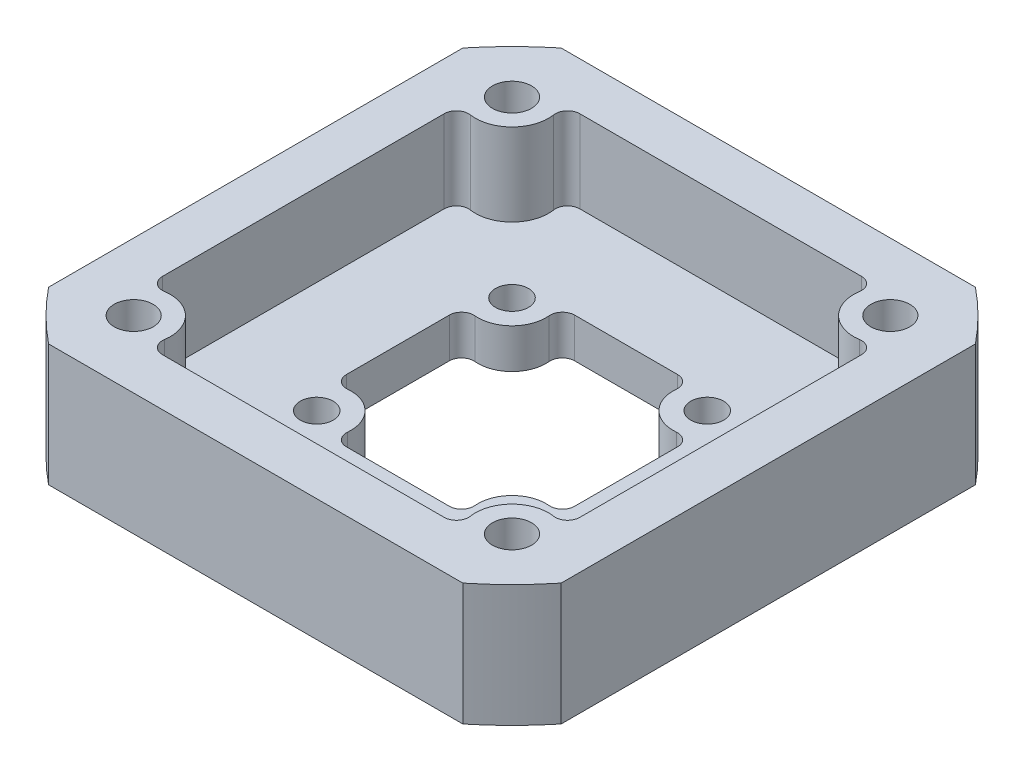
from build123d import *

# Parameters (mm, degrees)
SKETCH1_R           = 1.6
BOSS_EXTRUDE1_DEPTH = 10
SKETCH1_3_R         = 1.35
BOSS_EXTRUDE2_DEPTH = 3.25
FILLET1_R           = 1


with BuildPart() as part:
    # Sketch1 → Boss-Extrude1 (new body)
    with BuildSketch(Plane(origin=(0, 0, 0), x_dir=(1, 0, 0), z_dir=(0, 1, 0))):
        with BuildLine():
            Line((16.971, 21), (-16.971, 21))
            ThreePointArc((-16.971, 21), (-19.092078518, 19.092078518), (-21, 16.971))
            Line((-21, 16.971), (-21, -16.971))
            ThreePointArc((-21, -16.971), (-19.092078518, -19.092078518), (-16.971, -21))
            Line((-16.971, -21), (16.971, -21))
            ThreePointArc((16.971, -21), (19.092078518, -19.092078518), (21, -16.971))
            Line((21, -16.971), (21, 16.971))
            ThreePointArc((21, 16.971), (19.092078518, 19.092078518), (16.971, 21))
        make_face()
        with Locations((-15.5, -15.5)):
            Circle(SKETCH1_R, mode=Mode.SUBTRACT)
        with Locations((15.5, -15.5)):
            Circle(SKETCH1_R, mode=Mode.SUBTRACT)
        with Locations((-15.5, 15.5)):
            Circle(SKETCH1_R, mode=Mode.SUBTRACT)
        with BuildLine():
            Line((-17.1, -12.962284492), (-17.1, 12.962284492))
            ThreePointArc((-17.1, 12.962284492), (-13.378679656, 13.378679656), (-12.962284492, 17.1))
            Line((-12.962284492, 17.1), (12.962284492, 17.1))
            ThreePointArc((12.962284492, 17.1), (13.378679656, 13.378679656), (17.1, 12.962284492))
            Line((17.1, 12.962284492), (17.1, -12.962284492))
            ThreePointArc((17.1, -12.962284492), (13.378679656, -13.378679656), (12.962284492, -17.1))
            Line((12.962284492, -17.1), (-12.962284492, -17.1))
            ThreePointArc((-12.962284492, -17.1), (-13.378679656, -13.378679656), (-17.1, -12.962284492))
        make_face(mode=Mode.SUBTRACT)
        with Locations((15.5, 15.5)):
            Circle(SKETCH1_R, mode=Mode.SUBTRACT)
    extrude(amount=BOSS_EXTRUDE1_DEPTH)

    # Sketch1<3> → Boss-Extrude2 (add)
    with BuildSketch(Plane(origin=(0, 0, 0), x_dir=(1, 0, 0), z_dir=(0, 1, 0))):
        with BuildLine():
            ThreePointArc((-12.962284492, 17.1), (-13.378679656, 13.378679656), (-17.1, 12.962284492))
            Line((-17.1, 12.962284492), (-17.1, -12.962284492))
            ThreePointArc((-17.1, -12.962284492), (-13.378679656, -13.378679656), (-12.962284492, -17.1))
            Line((-12.962284492, -17.1), (12.962284492, -17.1))
            ThreePointArc((12.962284492, -17.1), (13.378679656, -13.378679656), (17.1, -12.962284492))
            Line((17.1, -12.962284492), (17.1, 12.962284492))
            ThreePointArc((17.1, 12.962284492), (13.378679656, 13.378679656), (12.962284492, 17.1))
            Line((12.962284492, 17.1), (-12.962284492, 17.1))
        make_face()
        with Locations((-8.000195426, -8.000195426)):
            Circle(SKETCH1_3_R, mode=Mode.SUBTRACT)
        with BuildLine():
            ThreePointArc((-9.350195426, 5.546745259), (-6.020296439, 6.019905586), (-5.547136112, 9.349804574))
            Line((-5.547136112, 9.349804574), (5.546745259, 9.349804574))
            ThreePointArc((5.546745259, 9.349804574), (6.019905586, 6.019905586), (9.349804574, 5.546745259))
            Line((9.349804574, 5.546745259), (9.349804574, -5.547136112))
            ThreePointArc((9.349804574, -5.547136112), (6.019905586, -6.020296439), (5.546745259, -9.350195426))
            Line((5.546745259, -9.350195426), (-5.547136112, -9.350195426))
            ThreePointArc((-5.547136112, -9.350195426), (-6.020296439, -6.020296439), (-9.350195426, -5.547136112))
            Line((-9.350195426, -5.547136112), (-9.350195426, 5.546745259))
        make_face(mode=Mode.SUBTRACT)
        with Locations((7.999804574, -8.000195426)):
            Circle(SKETCH1_3_R, mode=Mode.SUBTRACT)
        with Locations((-8.000195426, 7.999804574)):
            Circle(SKETCH1_3_R, mode=Mode.SUBTRACT)
        with Locations((7.999804574, 7.999804574)):
            Circle(SKETCH1_3_R, mode=Mode.SUBTRACT)
    extrude(amount=BOSS_EXTRUDE2_DEPTH)

    # Fillet1
    fillet1_edges = [part.edges().sort_by_distance(p)[0] for p in [
        (12.962284492, 6.625, 17.1),
        (17.1, 6.625, -12.962284492),
        (12.962284492, 6.625, -17.1),
        (-12.962284492, 6.625, -17.1),
        (-17.1, 6.625, -12.962284492),
        (-17.1, 6.625, 12.962284492),
        (-12.962284492, 6.625, 17.1),
        (-5.547136112, 1.625, 9.350195426),
        (-9.350195426, 1.625, 5.547136112),
        (5.546745259, 1.625, 9.350195426),
        (9.349804574, 1.625, 5.547136112),
        (9.349804574, 1.625, -5.546745259),
        (5.546745259, 1.625, -9.349804574),
        (-5.547136112, 1.625, -9.349804574),
        (-9.350195426, 1.625, -5.546745259),
        (17.1, 6.625, 12.962284492),
    ]]
    fillet(fillet1_edges, radius=FILLET1_R)


solid = part.part
